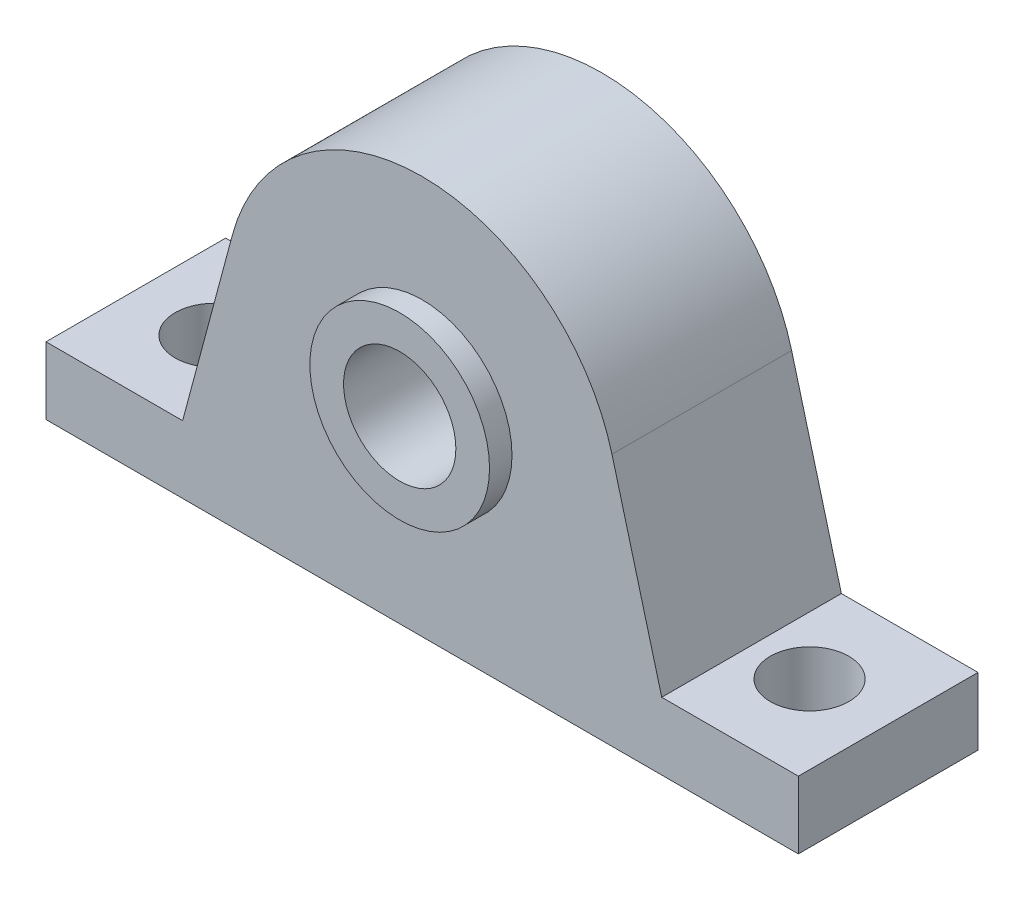
from build123d import *

# Parameters (mm, degrees)
SKETCH_1_R          = 17.5
SKETCH_1_R_2        = 5
EXTRUDE_1_DEPTH     = 16
SKETCH_2_R          = 8
SKETCH_2_R_2        = 5
EXTRUDE_2_DEPTH     = 2
SKETCH_3_R          = 3.5
CUT_EXTRUDE_1_DEPTH = 12


with BuildPart() as part:
    # 草图1 → 凸台-拉伸1 (new body)
    # profile 1 of 2: a face of its own
    with BuildSketch(Plane.XY):
        with BuildLine():
            Line((-33.5, 6), (-33.5, 0))
            Line((-33.5, 0), (33.5, 0))
            Line((33.5, 0), (33.5, 6))
            Line((33.5, 6), (21.332723466, 6))
            Line((21.332723466, 6), (16.90370196, 22.529333289))
            ThreePointArc((16.90370196, 22.529333289), (17.350285074, 20.284208364), (17.5, 18))
            ThreePointArc((17.5, 18), (-2.284208364, 0.649714926), (-16.90370196, 22.529333289))
            Line((-16.90370196, 22.529333289), (-21.332723466, 6))
            Line((-21.332723466, 6), (-33.5, 6))
        make_face()
    # profile 2 of 2: a face of its own
    with BuildSketch(Plane.XY):
        with Locations((0, 18)):
            Circle(SKETCH_1_R)
        with Locations((0, 18)):
            Circle(SKETCH_1_R_2, mode=Mode.SUBTRACT)
    extrude(amount=EXTRUDE_1_DEPTH)

    # 草图2 → 凸台-拉伸2 (add)
    with BuildSketch(Plane.XY.offset(16)):
        with Locations((0, 18)):
            Circle(SKETCH_2_R)
        with Locations((0, 18)):
            Circle(SKETCH_2_R_2, mode=Mode.SUBTRACT)
    extrude(amount=EXTRUDE_2_DEPTH)

    # 草图3 → 切除-拉伸1 (cut)
    with BuildSketch(Plane(origin=(0, 6, 0), x_dir=(1, 0, 0), z_dir=(0, 1, 0))):
        with Locations(Location((-26.5, -8, 0), (0, 0, 270))):
            Circle(SKETCH_3_R)
        with Locations(Location((26.5, -8, 0), (0, 0, 180))):
            Circle(SKETCH_3_R)
    extrude(amount=-CUT_EXTRUDE_1_DEPTH, mode=Mode.SUBTRACT)


solid = part.part
